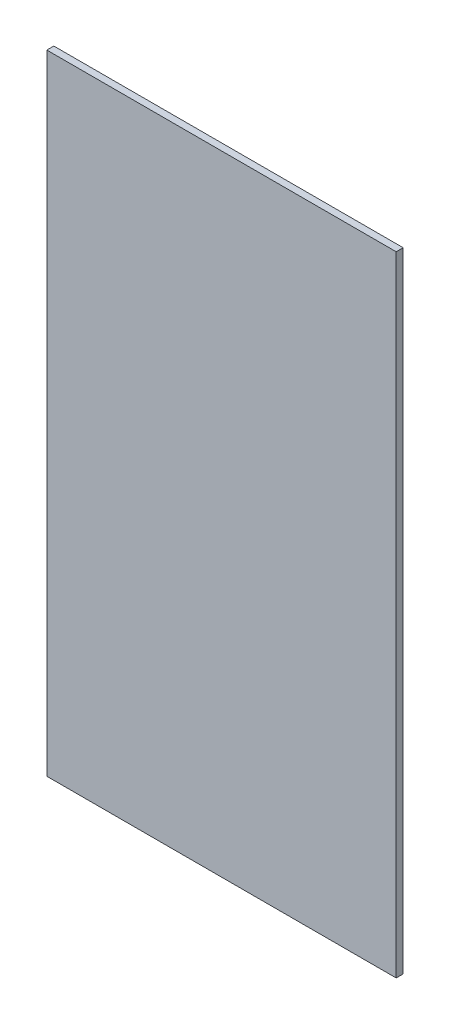
from build123d import *

# Parameters (mm, degrees)
SKETCH_1_W      = 5000
SKETCH_1_H      = 9000
EXTRUDE_1_DEPTH = 50


with BuildPart() as part:
    # 草图1 → 凸台-拉伸1 (new, symmetric)
    with BuildSketch(Plane.XY):
        Rectangle(SKETCH_1_W, SKETCH_1_H)
    extrude(amount=EXTRUDE_1_DEPTH, both=True)


solid = part.part
